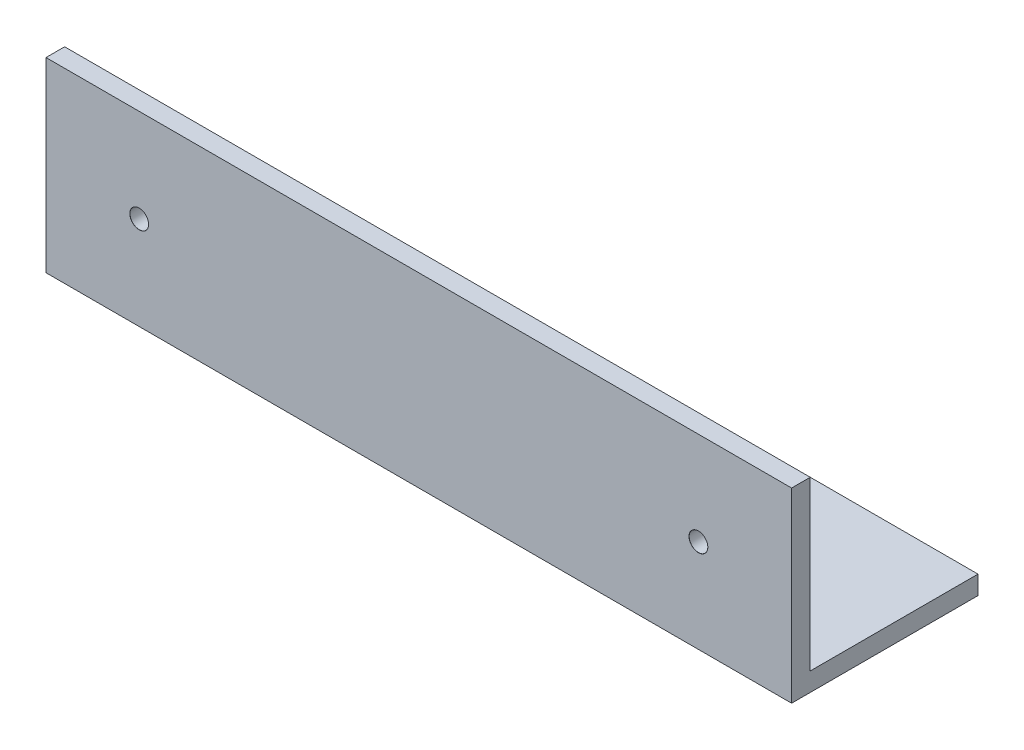
from build123d import *

# Parameters (mm, degrees)
EXTRUDE_THIN1_DEPTH            = 100
F_5_0MM_DOWEL_HOLE1_AT_2_COUNT = 2
F_5_0MM_DOWEL_HOLE1_AT_2_PITCH = 150
F_5_0MM_DOWEL_HOLE2_AT_2_COUNT = 2
F_5_0MM_DOWEL_HOLE2_AT_2_PITCH = 150


with BuildPart() as part:
    # Sketch2 → Extrude-Thin1 (new, symmetric)
    with BuildSketch(Plane(origin=(0, 0, 0), x_dir=(0, 0, -1), z_dir=(1, 0, 0))):
        Polygon((0, 50), (0, 0), (50, 0), (50, 5), (5, 5), (5, 50), align=None)
    extrude(amount=EXTRUDE_THIN1_DEPTH, both=True)

    # Sketch5 → Ø5.0mm Dowel Hole1 (revolve, cut)
    with BuildSketch(Plane(origin=(75, 25, -5), x_dir=(0, 1, 0), z_dir=(1, 0, 0))):
        Polygon((0, 0), (0, 5), (2.525, 5), (2.5, 4.975), (2.5, 0), align=None)
    f_5_0mm_dowel_hole1 = revolve(axis=Axis((75, 25, -11.35), (0, 0, 1)), mode=Mode.SUBTRACT)

    # Ø5.0mm Dowel Hole1 at 2: Ø5.0mm Dowel Hole1 ×2
    with Locations(*[(-i * F_5_0MM_DOWEL_HOLE1_AT_2_PITCH, 0, 0) for i in range(1, F_5_0MM_DOWEL_HOLE1_AT_2_COUNT)]):
        add(f_5_0mm_dowel_hole1, mode=Mode.SUBTRACT)

    # Sketch7 → Ø5.0mm Dowel Hole2 (revolve, cut)
    with BuildSketch(Plane(origin=(-75, 5, -25), x_dir=(0, 0, 1), z_dir=(1, 0, 0))):
        Polygon((0, 0), (0, 5), (2.525, 5), (2.5, 4.975), (2.5, 0), align=None)
    f_5_0mm_dowel_hole2 = revolve(axis=Axis((-75, 11.35, -25), (0, -1, 0)), mode=Mode.SUBTRACT)

    # Ø5.0mm Dowel Hole2 at 2: Ø5.0mm Dowel Hole2 ×2
    with Locations(*[(i * F_5_0MM_DOWEL_HOLE2_AT_2_PITCH, 0, 0) for i in range(1, F_5_0MM_DOWEL_HOLE2_AT_2_COUNT)]):
        add(f_5_0mm_dowel_hole2, mode=Mode.SUBTRACT)


solid = part.part
